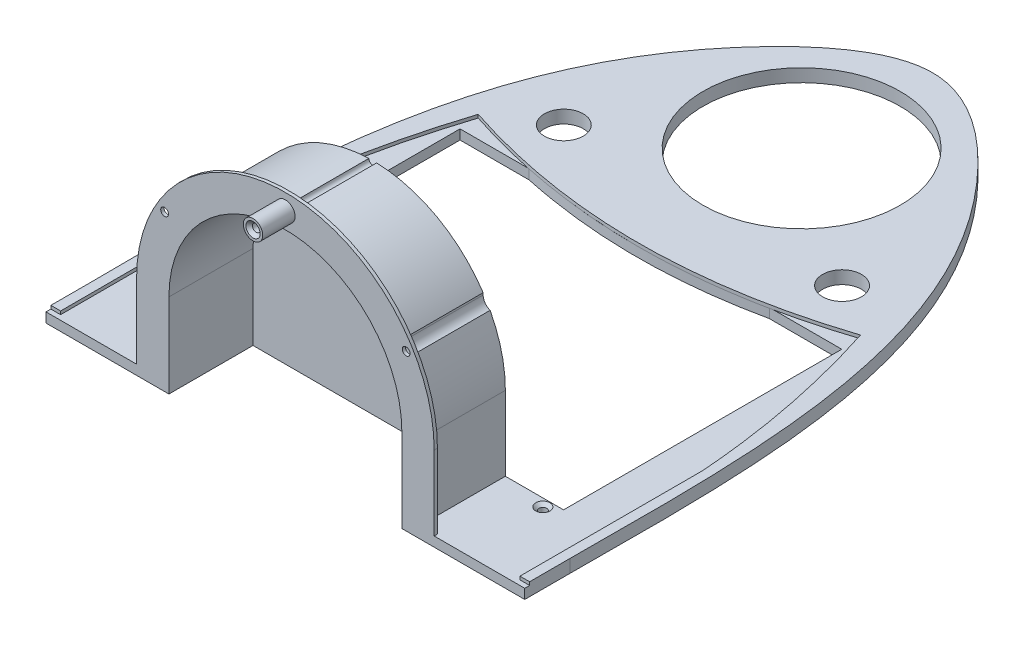
from build123d import *

# Parameters (mm, degrees)
SKETCH3_R                                            = 30.500804908
SKETCH3_R_2                                          = 5.995731032
SKETCH3_R_3                                          = 6.004912971
BOSS_EXTRUDE1_DEPTH                                  = 4
CUT_EXTRUDE1_DEPTH                                   = 201.334085664
CUT_EXTRUDE1_DEPTH_BACK                              = 1
CUT_EXTRUDE2_DEPTH                                   = 10
BOSS_EXTRUDE2_DEPTH                                  = 23
SKETCH8_W                                            = 46.001518713
SKETCH8_H                                            = 27
REVOLVE1_ANGLE                                       = 180
CUT_EXTRUDE3_DEPTH                                   = 26
FILLET1_R                                            = 1
CSK_FOR_M2_COUNTERSUNK_RAISED_HEAD_SCREW_D           = 2.4
CSK_FOR_M2_COUNTERSUNK_RAISED_HEAD_SCREW_CSINK_D     = 4.4
CSK_FOR_M2_COUNTERSUNK_RAISED_HEAD_SCREW_CSINK_ANGLE = 90
CSK_FOR_M2_COUNTERSUNK_RAISED_HEAD_S_2_D             = 2.4
CSK_FOR_M2_COUNTERSUNK_RAISED_HEAD_S_2_CSINK_D       = 4.4
CSK_FOR_M2_COUNTERSUNK_RAISED_HEAD_S_2_CSINK_ANGLE   = 90
CUT_EXTRUDE4_DEPTH                                   = 26
CUT_EXTRUDE6_DEPTH                                   = 26
CSK_FOR_M2_COUNTERSUNK_RAISED_HEAD_S_3_D             = 2.4
CSK_FOR_M2_COUNTERSUNK_RAISED_HEAD_S_3_CSINK_D       = 4.4
CSK_FOR_M2_COUNTERSUNK_RAISED_HEAD_S_3_CSINK_ANGLE   = 90
SKETCH21_W                                           = 3.203626312
SKETCH21_H                                           = 1.504144349
SKETCH21_W_2                                         = 3.379717773
CUT_EXTRUDE7_DEPTH                                   = 1
SKETCH26_R                                           = 3.001958304
BOSS_EXTRUDE4_DEPTH                                  = 10
CSK_FOR_M2_COUNTERSUNK_FLAT_HEAD_SCREW1_D            = 2.4
CSK_FOR_M2_COUNTERSUNK_FLAT_HEAD_SCREW1_CSINK_D      = 4.4
CSK_FOR_M2_COUNTERSUNK_FLAT_HEAD_SCREW1_CSINK_ANGLE  = 90


with BuildPart() as part:
    # Sketch3 → Boss-Extrude1 (new body)
    with BuildSketch(Plane(origin=(0, 0, 0), x_dir=(1, 0, 0), z_dir=(0, 1, 0))):
        with BuildLine():
            Line((-74, 0), (-74, -13.999975782))
            Line((-74, -13.999975782), (74, -13.999975782))
            Line((74, -13.999975782), (74, 0))
            add(Edge.make_bspline(
                [(74, 0), (74.231196296, 56.043971303), (77.023704063, 134.891433867), (0.000522637, 195.647038294), (-77.018807985, 134.889235124), (-74.23221909, 56.044664754), (-74, 0)],
                knots=[0, 0, 0, 0, 0.406629726, 0.500002159, 0.593368057, 1, 1, 1, 1], degree=3))
        make_face()
        with Locations(Location((0, 145.588967501, 0), (0, 0, 270))):
            Circle(SKETCH3_R, mode=Mode.SUBTRACT)
        with Locations(Location((-43.002039148, 115.088162593, 0), (0, 0, 270))):
            Circle(SKETCH3_R_2, mode=Mode.SUBTRACT)
        with Locations(Location((43.002259074, 115.088162593, 0), (0, 0, 270))):
            Circle(SKETCH3_R_3, mode=Mode.SUBTRACT)
    extrude(amount=BOSS_EXTRUDE1_DEPTH)

    # Sketch4 → Cut-Extrude1 (cut, two sides: drawn at the far end of the back side and taken through both)
    with BuildSketch(Plane(origin=(0, 4, 0), x_dir=(1, 0, 0), z_dir=(0, 1, 0)).offset(-CUT_EXTRUDE1_DEPTH_BACK)):
        with BuildLine():
            Line((71.000110633, 44.001091932), (71.000110633, 6.067137952))
            Line((71.000110633, 6.067137952), (71.000110633, 5.938211201))
            Line((71.000110633, 5.938211201), (71.000110633, -16.998704323))
            Line((71.000110633, -16.998704323), (-70.996716676, -16.998704323))
            Line((-70.996716676, -16.998704323), (-70.996716676, 6.002699648))
            Line((-70.996716676, 6.002699648), (-70.996716676, 44.001117001))
            add(Edge.make_bspline(
                [(-59.092437552, 104.701767127), (-65.518680916, 84.707719391), (-69.486773958, 64.474169348), (-70.996716676, 44.001117001)],
                knots=[0.003076868, 0.003076868, 0.003076868, 0.003076868, 0.620649816, 0.620649816, 0.620649816, 0.620649816], degree=3))
            add(Edge.make_bspline(
                [(-59.092437552, 104.701767127), (-39.394984135, 98.235957793), (0.002749603, 91.769378921), (39.400586429, 98.235612751), (59.100918302, 104.702616137)],
                knots=[0.007529078, 0.007529078, 0.007529078, 0.007529078, 0.499976084, 0.992492475, 0.992492475, 0.992492475, 0.992492475], degree=3))
            add(Edge.make_bspline(
                [(59.100918302, 104.702616137), (65.524413648, 84.70806856), (69.490811091, 64.474227159), (71.000110633, 44.001091932)],
                knots=[0.003067815, 0.003067815, 0.003067815, 0.003067815, 0.620645861, 0.620645861, 0.620645861, 0.620645861], degree=3))
        make_face()
    extrude(amount=CUT_EXTRUDE1_DEPTH + CUT_EXTRUDE1_DEPTH_BACK, mode=Mode.SUBTRACT)

    # Sketch5 → Cut-Extrude2 (cut)
    with BuildSketch(Plane(origin=(0, 3, 0), x_dir=(1, 0, 0), z_dir=(0, 1, 0))):
        with BuildLine():
            Line((-37.63115667, 99.000024218), (-59.004553183, 99.000024218))
            Line((-59.004553183, 99.000024218), (-59.004553183, 13.000024218))
            Line((-59.004553183, 13.000024218), (59.003956031, 13.000024218))
            Line((59.003956031, 13.000024218), (59.003956031, 99.000024218))
            Line((59.003956031, 99.000024218), (36.603722574, 99.000024218))
            add(Edge.make_bspline(
                [(-37.63115667, 99.000024218), (-0.501932399, 91.00364322), (36.603722574, 99.000024218)],
                knots=[0, 0, 0, 1, 1, 1], degree=2))
        make_face()
    extrude(amount=-CUT_EXTRUDE2_DEPTH, mode=Mode.SUBTRACT)

    # Sketch7 → Boss-Extrude2 (add)
    with BuildSketch(Plane(origin=(0, 3, 0), x_dir=(1, 0, 0), z_dir=(0, 1, 0))):
        Polygon((-0.000298576, 13.000024218), (-45.998654577, 13.000024218), (-45.998654577, -13.999975782), (0.001696979, -13.999975782), (46.00438285, -13.999975782), (46.00438285, 13.000024218), align=None)
    extrude(amount=BOSS_EXTRUDE2_DEPTH)

    # Sketch8 → Revolve1 (revolve)
    with BuildSketch(Plane(origin=(0, 26, 0), x_dir=(1, 0, 0), z_dir=(0, 1, 0))):
        with Locations((-22.997895221, -0.499975782)):
            Rectangle(SKETCH8_W, SKETCH8_H)
    revolve(axis=Axis((0.002864136, 26, -13.000024218), (0, 0, -1)), revolution_arc=REVOLVE1_ANGLE)

    # Sketch9 → Cut-Extrude3 (cut)
    with BuildSketch(Plane(origin=(0, 0, -13.000024218), x_dir=(-1, 0, 0), z_dir=(0, 0, -1))):
        with BuildLine():
            Line((-46.00438285, 4), (-46.00438285, 26))
            ThreePointArc((-46.00438285, 26), (-0.002864136, 72.001518714), (45.998654577, 26))
            Line((45.998654577, 26), (45.998654577, 4))
            Line((45.998654577, 4), (45.998654577, 3))
            Line((45.998654577, 3), (41.002011799, 3))
            Line((41.002011799, 3), (41.002011799, 4))
            Line((41.002011799, 4), (41.002011799, 26))
            ThreePointArc((41.002011799, 26), (-0.003137153, 67.005148952), (-41.008286105, 26))
            Line((-41.008286105, 26), (-41.008286105, 4))
            Line((-41.008286105, 4), (-41.008286105, 3))
            Line((-41.008286105, 3), (-46.00438285, 3))
            Line((-46.00438285, 3), (-46.00438285, 4))
        make_face()
    extrude(amount=-CUT_EXTRUDE3_DEPTH, mode=Mode.SUBTRACT)

    # Fillet1
    fillet1_edges = [part.edges().sort_by_distance(p)[0] for p in [
        (41.008286105, 14.5, 12.999975782),
        (0.003137153, 67.005148952, 12.999975782),
        (-41.002011799, 14.5, 12.999975782),
    ]]
    fillet(fillet1_edges, radius=FILLET1_R)

    # CSK for M2 Countersunk Raised Head Screw (through all)
    with Locations(Plane(origin=(37.341283937, 48.105109247, -13.000024218), x_dir=(-1, 0, 0), z_dir=(0, 0, -1))):
        with Locations((0, 0)):
            CounterSinkHole(CSK_FOR_M2_COUNTERSUNK_RAISED_HEAD_SCREW_D / 2, CSK_FOR_M2_COUNTERSUNK_RAISED_HEAD_SCREW_CSINK_D / 2, counter_sink_angle=CSK_FOR_M2_COUNTERSUNK_RAISED_HEAD_SCREW_CSINK_ANGLE)

    # CSK for M2 Countersunk Raised Head S 2 (through all)
    with Locations(Plane(origin=(-37.336467168, 48.105109247, -13.000024218), x_dir=(-1, 0, 0), z_dir=(0, 0, -1))):
        with Locations((0, 0)):
            CounterSinkHole(CSK_FOR_M2_COUNTERSUNK_RAISED_HEAD_S_2_D / 2, CSK_FOR_M2_COUNTERSUNK_RAISED_HEAD_S_2_CSINK_D / 2, counter_sink_angle=CSK_FOR_M2_COUNTERSUNK_RAISED_HEAD_S_2_CSINK_ANGLE)

    # Sketch13 → Cut-Extrude4 (cut)
    with BuildSketch(Plane(origin=(0, 0, 12.999975782), x_dir=(-1, 0, 0), z_dir=(0, 0, -1))):
        with BuildLine():
            Line((-40.537082061, 48.105109247), (-40.537082061, 50.119729722))
            Line((-40.537082061, 50.119729722), (-34.142461411, 57.934379624))
            Line((-34.142461411, 57.934379624), (-34.142461411, 48.105109247))
            ThreePointArc((-34.142461411, 48.105109247), (-35.078534783, 45.841172076), (-37.341283937, 44.902230579))
            ThreePointArc((-37.341283937, 44.902230579), (-39.602520891, 45.84179845), (-40.537082061, 48.105109247))
        make_face()
        with BuildLine():
            Line((34.132951582, 48.105109247), (34.132951582, 58.567156979))
            Line((34.132951582, 58.567156979), (40.534839533, 50.980581359))
            Line((40.534839533, 50.980581359), (40.534839533, 48.105109247))
            ThreePointArc((40.534839533, 48.105109247), (39.59899119, 45.841265256), (37.336467022, 44.902230579))
            ThreePointArc((37.336467022, 44.902230579), (35.070804229, 45.839632847), (34.132951582, 48.105109247))
        make_face()
    extrude(amount=CUT_EXTRUDE4_DEPTH, mode=Mode.SUBTRACT)

    # Sketch14 → Cut-Extrude6 (cut)
    with BuildSketch(Plane.XY.offset(13.999975782)):
        with BuildLine():
            Line((-36.001614282, 3), (-36.001614282, -2.003280718))
            Line((-36.001614282, -2.003280718), (36.004124987, -2.003280718))
            Line((36.004124987, -2.003280718), (36.004124987, 3))
            Line((36.004124987, 3), (36.004124987, 26))
            ThreePointArc((36.004124987, 26), (0.001255352, 62.002869635), (-36.001614282, 26))
            Line((-36.001614282, 26), (-36.001614282, 3))
        make_face()
    extrude(amount=-CUT_EXTRUDE6_DEPTH, mode=Mode.SUBTRACT)

    # CSK for M2 Countersunk Raised Head S 3 (through all)
    with Locations(Plane(origin=(-54.999469482, 3, -10.603702266), x_dir=(0, 0, 1), z_dir=(0, 1, 0))):
        with Locations((0, 0), (0, 109.999191574)):
            CounterSinkHole(CSK_FOR_M2_COUNTERSUNK_RAISED_HEAD_S_3_D / 2, CSK_FOR_M2_COUNTERSUNK_RAISED_HEAD_S_3_CSINK_D / 2, counter_sink_angle=CSK_FOR_M2_COUNTERSUNK_RAISED_HEAD_S_3_CSINK_ANGLE)

    # Sketch21 → Cut-Extrude7 (cut)
    with BuildSketch(Plane(origin=(0, 4, 0), x_dir=(1, 0, 0), z_dir=(0, 1, 0))):
        with Locations((-72.598529832, -13.247903608)):
            Rectangle(SKETCH21_W, SKETCH21_H)
        with Locations((72.68996952, -13.247903608)):
            Rectangle(SKETCH21_W_2, SKETCH21_H)
    extrude(amount=-CUT_EXTRUDE7_DEPTH, mode=Mode.SUBTRACT)

    # Sketch26 → Boss-Extrude4 (add)
    with BuildSketch(Plane.XY.offset(13.999975782)):
        with Locations(Location((0.002864136, 67.001518714, 0), (0, 0, 180))):
            Circle(SKETCH26_R)
    extrude(amount=BOSS_EXTRUDE4_DEPTH)

    # CSK for M2 Countersunk Flat Head Screw1 (through all)
    with Locations(Plane.XY.offset(23.999975782)):
        with Locations((0.002864136, 67.001518714)):
            CounterSinkHole(CSK_FOR_M2_COUNTERSUNK_FLAT_HEAD_SCREW1_D / 2, CSK_FOR_M2_COUNTERSUNK_FLAT_HEAD_SCREW1_CSINK_D / 2, counter_sink_angle=CSK_FOR_M2_COUNTERSUNK_FLAT_HEAD_SCREW1_CSINK_ANGLE)


solid = part.part
